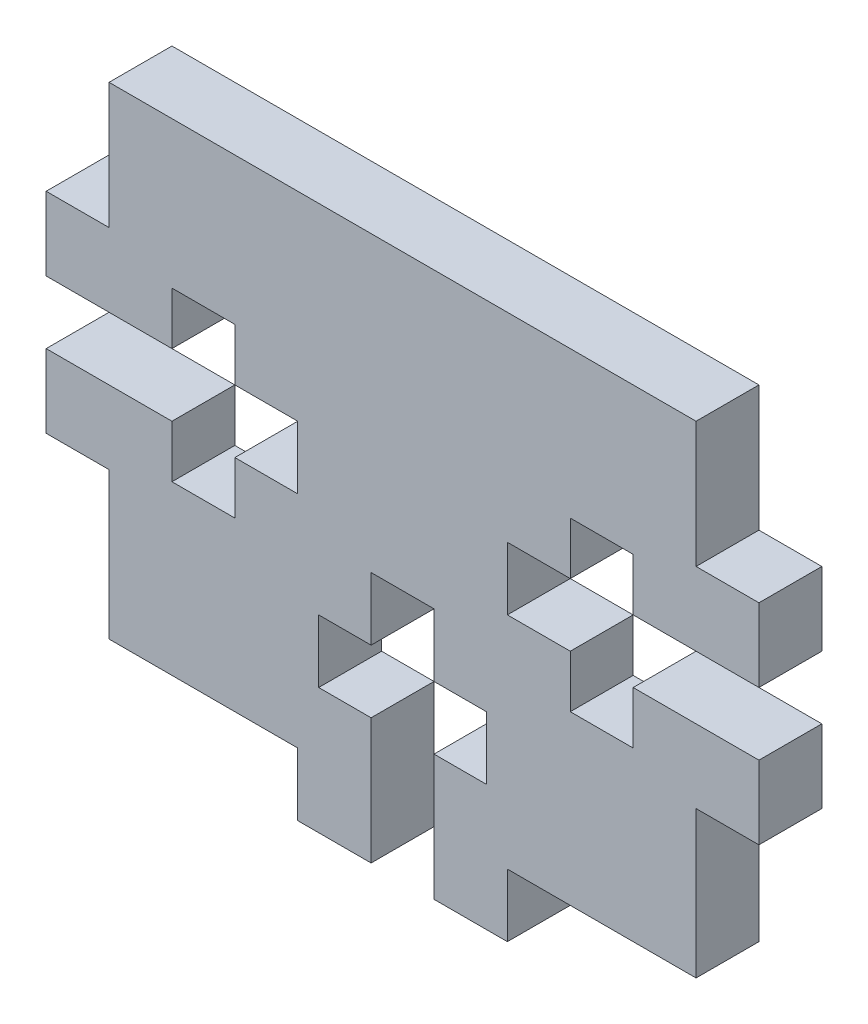
from build123d import *

# Parameters (mm, degrees)
SKETCH_1_W          = 28
SKETCH_1_H          = 24
SKETCH_1_W_2        = 3
SKETCH_1_H_2        = 10
SKETCH_1_W_3        = 10
SKETCH_1_H_3        = 3
EXTRUDE_1_DEPTH     = 3
SKETCH_2_W          = 6
SKETCH_2_H          = 3
SKETCH_2_W_2        = 3
SKETCH_2_H_2        = 2.5
SKETCH_2_W_3        = 2.5
SKETCH_2_H_3        = 6
CUT_EXTRUDE_1_DEPTH = 3
SKETCH_3_W          = 28
SKETCH_3_H          = 1
CUT_EXTRUDE_2_DEPTH = 3


with BuildPart() as part:
    # 草图1 → 凸台-拉伸1 (new body)
    with BuildSketch(Plane.XY):
        Rectangle(SKETCH_1_W, SKETCH_1_H)
        with Locations((-15.5, 0)):
            Rectangle(SKETCH_1_W_2, SKETCH_1_H_2)
        with Locations((15.5, 0)):
            Rectangle(SKETCH_1_W_2, SKETCH_1_H_2)
        with Locations((0, -13.5)):
            Rectangle(SKETCH_1_W_3, SKETCH_1_H_3)
    extrude(amount=EXTRUDE_1_DEPTH)

    # 草图2 → 切除-拉伸1 (cut)
    with BuildSketch(Plane.XY.offset(3)):
        with Locations((-14, 0)):
            Rectangle(SKETCH_2_W, SKETCH_2_H)
        with Locations((-9.5, 2.75)):
            Rectangle(SKETCH_2_W_2, SKETCH_2_H_2)
        with Locations((-9.5, 0)):
            Rectangle(SKETCH_2_W_2, SKETCH_2_H)
        with Locations((-9.5, -2.75)):
            Rectangle(SKETCH_2_W_2, SKETCH_2_H_2)
        with Locations((-6.5, 0)):
            Rectangle(SKETCH_2_W_2, SKETCH_2_H)
        with Locations((6.5, 0)):
            Rectangle(SKETCH_2_W_2, SKETCH_2_H)
        with Locations((9.5, 2.75)):
            Rectangle(SKETCH_2_W_2, SKETCH_2_H_2)
        with Locations((9.5, 0)):
            Rectangle(SKETCH_2_W_2, SKETCH_2_H)
        with Locations((9.5, -2.75)):
            Rectangle(SKETCH_2_W_2, SKETCH_2_H_2)
        with Locations((14, 0)):
            Rectangle(SKETCH_2_W, SKETCH_2_H)
        with Locations((-2.75, -7.5)):
            Rectangle(SKETCH_2_W_3, SKETCH_2_H)
        with Locations((0, -4.5)):
            Rectangle(SKETCH_2_W_2, SKETCH_2_H)
        with Locations((0, -7.5)):
            Rectangle(SKETCH_2_W_2, SKETCH_2_H)
        with Locations((2.75, -7.5)):
            Rectangle(SKETCH_2_W_3, SKETCH_2_H)
        with Locations((0, -12)):
            Rectangle(SKETCH_2_W_2, SKETCH_2_H_3)
    extrude(amount=-CUT_EXTRUDE_1_DEPTH, mode=Mode.SUBTRACT)

    # 草图3 → 切除-拉伸2 (cut)
    with BuildSketch(Plane.XY.offset(3)):
        with Locations((0, 11.5)):
            Rectangle(SKETCH_3_W, SKETCH_3_H)
    extrude(amount=-CUT_EXTRUDE_2_DEPTH, mode=Mode.SUBTRACT)


solid = part.part
